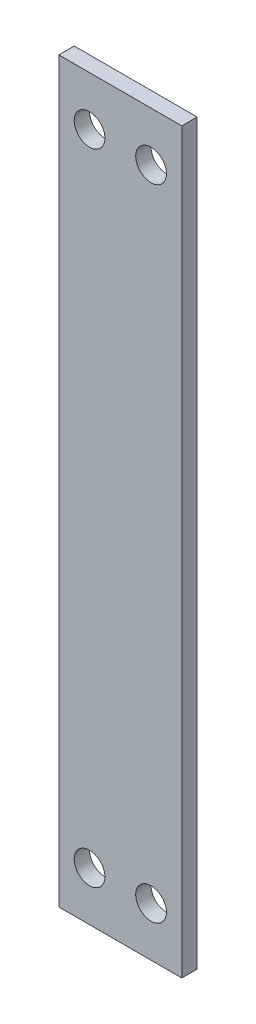
from build123d import *

# Parameters (mm, degrees)
SKETCH1_W           = 38.1
SKETCH1_H           = 228.6
SKETCH1_R           = 4.7625
BOSS_EXTRUDE1_DEPTH = 4.7625


with BuildPart() as part:
    # Sketch1 → Boss-Extrude1 (new body)
    with BuildSketch(Plane.XY):
        with Locations((19.05, 114.3)):
            Rectangle(SKETCH1_W, SKETCH1_H)
        with Locations(Location((9.525, 15.24, 0), (0, 0, 180))):
            Circle(SKETCH1_R, mode=Mode.SUBTRACT)
        with Locations(Location((28.575, 15.24, 0), (0, 0, 180))):
            Circle(SKETCH1_R, mode=Mode.SUBTRACT)
        with Locations(Location((9.525, 213.36, 0), (0, 0, 180))):
            Circle(SKETCH1_R, mode=Mode.SUBTRACT)
        with Locations(Location((28.575, 213.36, 0), (0, 0, 180))):
            Circle(SKETCH1_R, mode=Mode.SUBTRACT)
    extrude(amount=BOSS_EXTRUDE1_DEPTH)


solid = part.part
